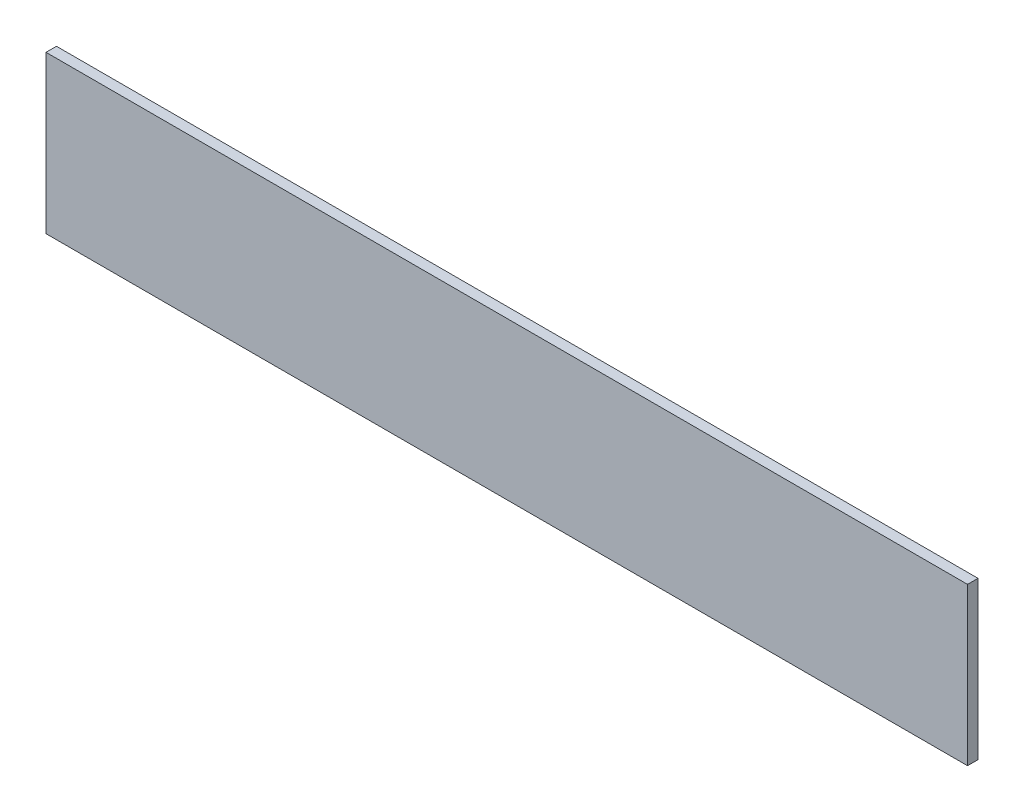
from build123d import *

# Parameters (mm, degrees)
SKETCH_1_W      = 88
SKETCH_1_H      = 15
EXTRUDE_1_DEPTH = 1


with BuildPart() as part:
    # ｽｹｯﾁ1 → ﾎﾞｽ - 押し出し1 (new body)
    with BuildSketch(Plane.XY):
        Rectangle(SKETCH_1_W, SKETCH_1_H)
    extrude(amount=EXTRUDE_1_DEPTH)


solid = part.part
